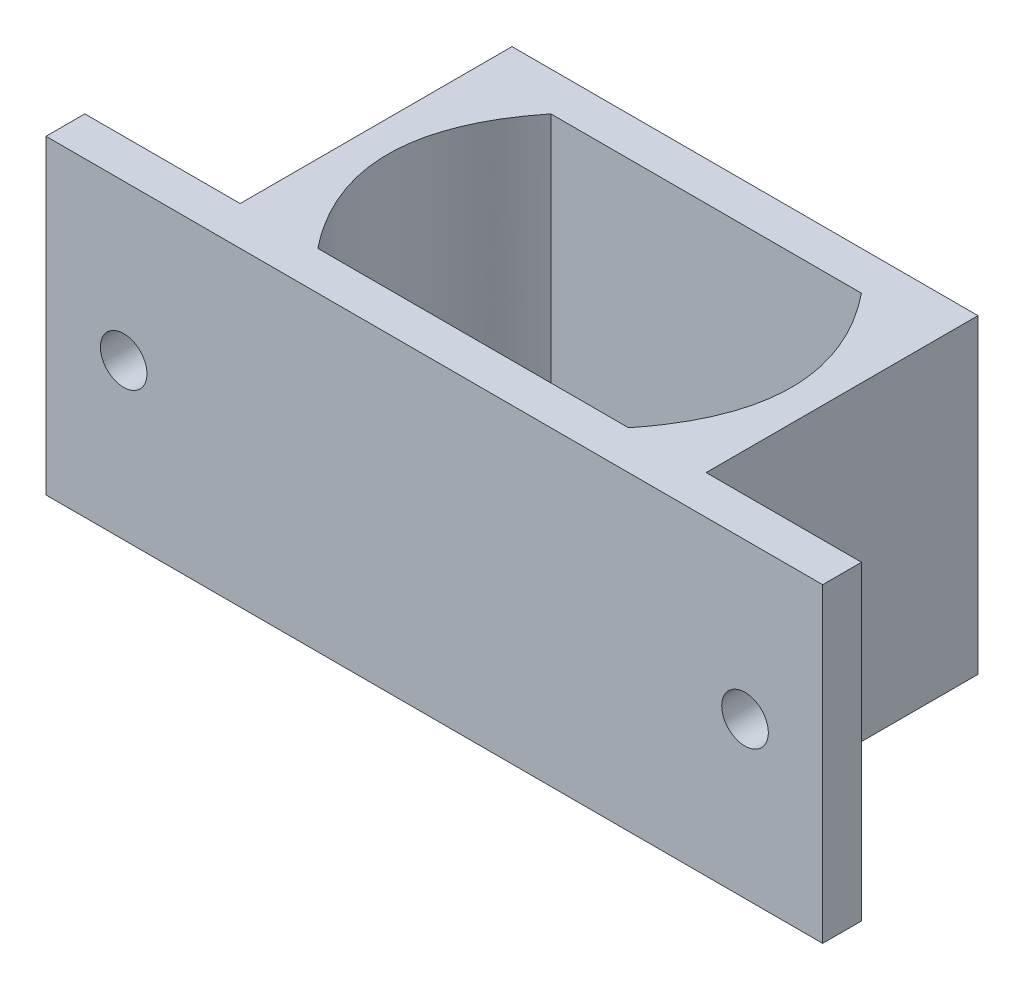
from build123d import *

# Parameters (mm, degrees)
BOSS_EXTRUDE3_DEPTH = 20
SKETCH2_W           = 10
SKETCH2_H           = 2.5
BOSS_EXTRUDE6_DEPTH = 20
SKETCH5_R           = 1.5
CUT_EXTRUDE1_DEPTH  = 20


with BuildPart() as part:
    # Sketch1 → Boss-Extrude3 (new body)
    with BuildSketch(Plane(origin=(0, 0, 0), x_dir=(1, 0, 0), z_dir=(0, 1, 0))):
        with BuildLine():
            add(Edge.make_bspline(
                [(-8.130019969, 7.5), (-11.130019969, 3.75), (-11.130019969, 0)],
                knots=[0, 0, 0, 0.5, 0.5, 0.5], degree=2))
            Line((-8.130019969, 7.5), (-13.130019969, 7.5))
            Line((-13.130019969, 7.5), (-13.130019969, -10))
            Line((-13.130019969, -10), (16.869980031, -10))
            Line((16.869980031, -10), (16.869980031, -7.5))
            Line((16.869980031, -7.5), (11.869980031, -7.5))
            Line((11.869980031, -7.5), (-8.130019969, -7.5))
            add(Edge.make_bspline(
                [(-11.130019969, 0), (-11.130019969, -3.75), (-8.130019969, -7.5)],
                knots=[0.5, 0.5, 0.5, 1, 1, 1], degree=2))
        make_face()
        with BuildLine():
            Line((-13.130019969, 7.5), (-8.130019969, 7.5))
            Line((-8.130019969, 7.5), (11.869980031, 7.5))
            add(Edge.make_bspline(
                [(11.869980031, 7.5), (14.869980031, 3.75), (14.869980031, 0)],
                knots=[0, 0, 0, 0.5, 0.5, 0.5], degree=2))
            add(Edge.make_bspline(
                [(14.869980031, 0), (14.869980031, -3.75), (11.869980031, -7.5)],
                knots=[0.5, 0.5, 0.5, 1, 1, 1], degree=2))
            Line((11.869980031, -7.5), (16.869980031, -7.5))
            Line((16.869980031, -7.5), (16.869980031, 10))
            Line((16.869980031, 10), (-13.130019969, 10))
            Line((-13.130019969, 10), (-13.130019969, 7.5))
        make_face()
    extrude(amount=BOSS_EXTRUDE3_DEPTH)

    # Sketch2 → Boss-Extrude6 (add)
    with BuildSketch(Plane(origin=(0, 20, 0), x_dir=(1, 0, 0), z_dir=(0, 1, 0))):
        with Locations((21.869980031, -8.75)):
            Rectangle(SKETCH2_W, SKETCH2_H)
        with Locations((-18.130019969, -8.75)):
            Rectangle(SKETCH2_W, SKETCH2_H)
    extrude(amount=-BOSS_EXTRUDE6_DEPTH)

    # Sketch5 → Cut-Extrude1 (cut)
    with BuildSketch(Plane(origin=(0, 0, 7.5), x_dir=(-1, 0, 0), z_dir=(0, 0, -1))):
        with Locations((18.130019969, 10)):
            Circle(SKETCH5_R)
        with Locations((-21.869980031, 10)):
            Circle(SKETCH5_R)
    extrude(amount=-CUT_EXTRUDE1_DEPTH, mode=Mode.SUBTRACT)


solid = part.part
